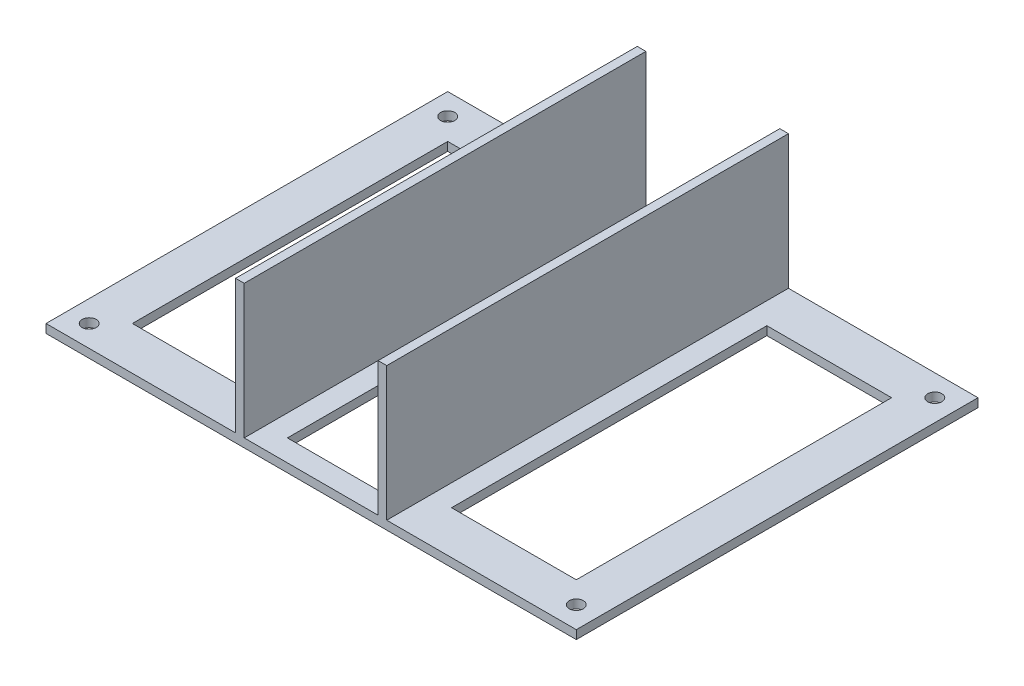
from build123d import *

# Parameters (mm, degrees)
SKETCH1_W           = 122.77
SKETCH1_H           = 93
SKETCH1_R           = 1.63
BOSS_EXTRUDE1_DEPTH = 2
SKETCH2_W           = 2
SKETCH2_H           = 93
BOSS_EXTRUDE2_DEPTH = 31
SKETCH3_W           = 28.885
SKETCH3_H           = 73
SKETCH3_W_2         = 21
SKETCH3_H_2         = 83
CUT_EXTRUDE1_DEPTH  = 176.967075005


with BuildPart() as part:
    # Sketch1 → Boss-Extrude1 (new body)
    with BuildSketch(Plane(origin=(0, 0, 0), x_dir=(1, 0, 0), z_dir=(0, 1, 0))):
        with Locations((-105.371378726, 0.358527933)):
            Rectangle(SKETCH1_W, SKETCH1_H)
        with Locations(Location((-161.756378726, 41.858527933, 0), (0, 0, 270))):
            Circle(SKETCH1_R, mode=Mode.SUBTRACT)
        with Locations(Location((-48.986378726, 41.858527933, 0), (0, 0, 270))):
            Circle(SKETCH1_R, mode=Mode.SUBTRACT)
        with Locations(Location((-161.756378726, -41.141472067, 0), (0, 0, 270))):
            Circle(SKETCH1_R, mode=Mode.SUBTRACT)
        with Locations(Location((-48.986378726, -41.141472067, 0), (0, 0, 270))):
            Circle(SKETCH1_R, mode=Mode.SUBTRACT)
    extrude(amount=BOSS_EXTRUDE1_DEPTH)

    # Sketch2 → Boss-Extrude2 (add)
    with BuildSketch(Plane(origin=(0, 2, 0), x_dir=(1, 0, 0), z_dir=(0, 1, 0))):
        with Locations((-121.871378726, 0.358527933)):
            Rectangle(SKETCH2_W, SKETCH2_H)
        with Locations((-88.871378726, 0.358527933)):
            Rectangle(SKETCH2_W, SKETCH2_H)
    extrude(amount=BOSS_EXTRUDE2_DEPTH)

    # Sketch3 → Cut-Extrude1 (cut, through all)
    with BuildSketch(Plane(origin=(0, 2, 0), x_dir=(1, 0, 0), z_dir=(0, 1, 0))):
        with Locations((-142.313878726, 0.358527933)):
            Rectangle(SKETCH3_W, SKETCH3_H)
        with Locations((-105.371378726, 0.358527933)):
            Rectangle(SKETCH3_W_2, SKETCH3_H_2)
        with Locations((-68.428878726, 0.358527933)):
            Rectangle(SKETCH3_W, SKETCH3_H)
    extrude(amount=-CUT_EXTRUDE1_DEPTH, mode=Mode.SUBTRACT)


solid = part.part
